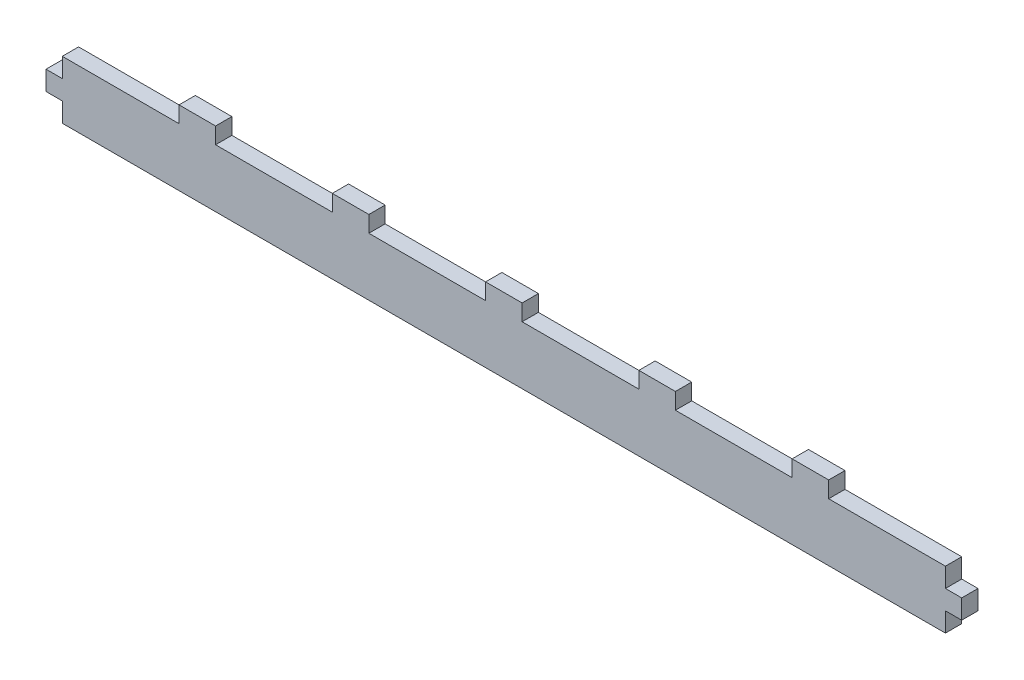
from build123d import *

# Parameters (mm, degrees)
BOSS_EXTRUDE1_DEPTH = 5.35


with BuildPart() as part:
    # Model → Boss-Extrude1 (new body)
    with BuildSketch(Plane.XY):
        Polygon((145, 12.7), (145, 19.05), (106.666, 19.05), (106.666, 24.4), (94.666, 24.4), (94.666, 19.05), (56.333, 19.05), (56.333, 24.4), (44.333, 24.4), (44.333, 19.05), (6, 19.05), (6, 24.4), (-6, 24.4), (-6, 19.05), (-44.333, 19.05), (-44.333, 24.4), (-56.333, 24.4), (-56.333, 19.05), (-94.666, 19.05), (-94.666, 24.4), (-106.666, 24.4), (-106.666, 19.05), (-145, 19.05), (-145, 12.7), (-150.35, 12.7), (-150.35, 6.35), (-145, 6.35), (-145, 0), (145, 0), (145, 6.35), (150.35, 6.35), (150.35, 12.7), align=None)
    extrude(amount=BOSS_EXTRUDE1_DEPTH)


solid = part.part
